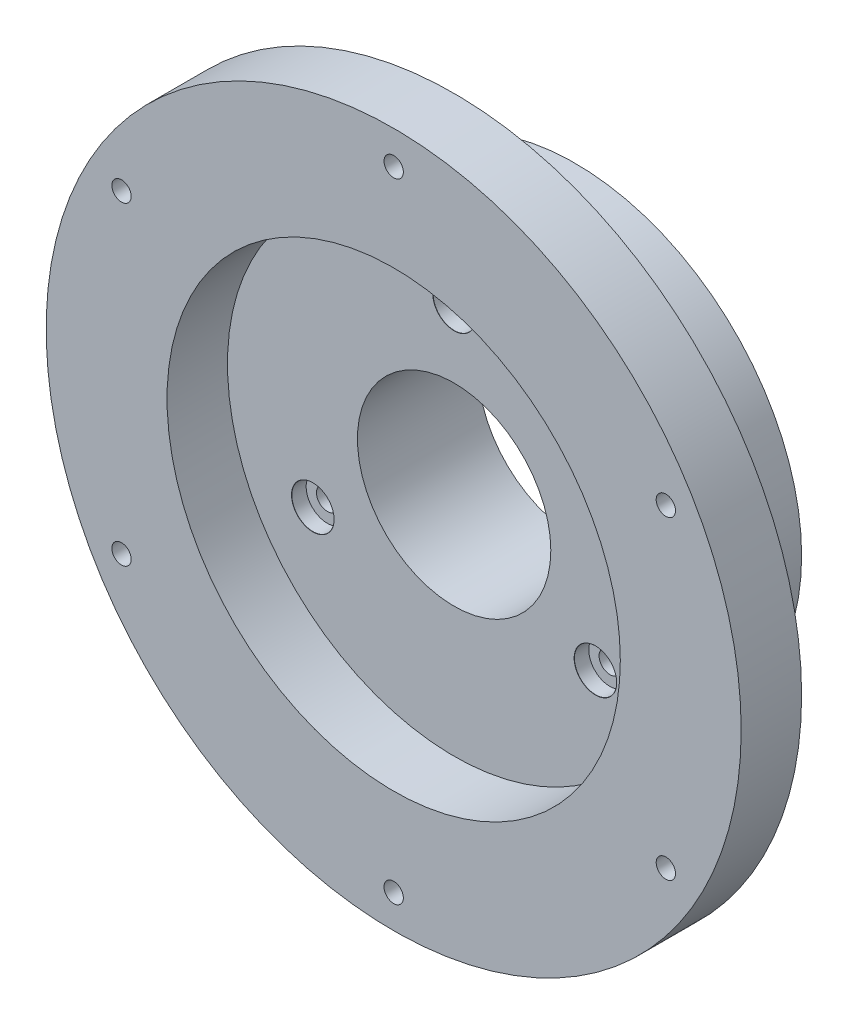
from build123d import *

# Parameters (mm, degrees)
SKETCH1_R                                     = 37.5
SKETCH1_R_2                                   = 16
BOSS_EXTRUDE1_DEPTH                           = 20
CBORE_FOR_M3_PAN_HEAD_MACHINE_SCREW1_AT_COUNT = 2
CBORE_FOR_M3_PAN_HEAD_MACHINE_SCREW1_AT_PITCH = 46.765371804
CBORE_FOR_M3_PAN_HEAD_MACHINE_SCREW1_2_COUNT  = 2
CBORE_FOR_M3_PAN_HEAD_MACHINE_SCREW1_2_PITCH  = 46.765371804
SKETCH8_R                                     = 57.5
SKETCH8_R_2                                   = 37.5
BOSS_EXTRUDE3_DEPTH                           = 10
SKETCH9_R                                     = 1.6
CUT_EXTRUDE1_DEPTH                            = 87.674679117


with BuildPart() as part:
    # Sketch1 → Boss-Extrude1 (new body)
    with BuildSketch(Plane.XY):
        Circle(SKETCH1_R)
        Circle(SKETCH1_R_2, mode=Mode.SUBTRACT)
    extrude(amount=BOSS_EXTRUDE1_DEPTH)

    # Sketch3 → CBORE for M3 Pan Head Machine Screw1 (revolve, cut)
    with BuildSketch(Plane(origin=(0, 27, 20), x_dir=(0, -1, 0), z_dir=(1, 0, 0))):
        Polygon((0, 0), (0, 20), (1.8, 20), (1.8, 2.4), (3.5, 2.4), (3.5, 0.025), (3.525, 0), align=None)
    cbore_for_m3_pan_head_machine_screw1 = revolve(axis=Axis((0, 27, 26.35), (0, 0, -1)), mode=Mode.SUBTRACT)

    # CBORE for M3 Pan Head Machine Screw1 at: CBORE for M3 Pan Head Machine Screw1 ×2
    with Locations(*[Vector(-0.500000000000001, -0.8660254037844382, 0) * (i * CBORE_FOR_M3_PAN_HEAD_MACHINE_SCREW1_AT_PITCH) for i in range(1, CBORE_FOR_M3_PAN_HEAD_MACHINE_SCREW1_AT_COUNT)]):
        add(cbore_for_m3_pan_head_machine_screw1, mode=Mode.SUBTRACT)

    # CBORE for M3 Pan Head Machine Screw1 2: CBORE for M3 Pan Head Machine Screw1 ×2
    with Locations(*[Vector(0.5000000000000012, -0.866025403784438, 0) * (i * CBORE_FOR_M3_PAN_HEAD_MACHINE_SCREW1_2_PITCH) for i in range(1, CBORE_FOR_M3_PAN_HEAD_MACHINE_SCREW1_2_COUNT)]):
        add(cbore_for_m3_pan_head_machine_screw1, mode=Mode.SUBTRACT)


with BuildPart() as body_2:
    # Sketch8 → Boss-Extrude3 (new body)
    with BuildSketch(Plane.XY.offset(30)):
        Circle(SKETCH8_R)
        Circle(SKETCH8_R_2, mode=Mode.SUBTRACT)
    extrude(amount=-BOSS_EXTRUDE3_DEPTH)

    # Sketch9 → Cut-Extrude1 (cut, through all)
    with BuildSketch(Plane.XY.offset(30)):
        with Locations((0, 52)):
            Circle(SKETCH9_R)
        with Locations((45.033320997, 26)):
            Circle(SKETCH9_R)
        with Locations((45.033320997, -26)):
            Circle(SKETCH9_R)
        with Locations((0, -52)):
            Circle(SKETCH9_R)
        with Locations((-45.033320997, -26)):
            Circle(SKETCH9_R)
        with Locations((-45.033320997, 26)):
            Circle(SKETCH9_R)
    extrude(amount=-CUT_EXTRUDE1_DEPTH, mode=Mode.SUBTRACT)


solid = Compound([part.part, body_2.part])
